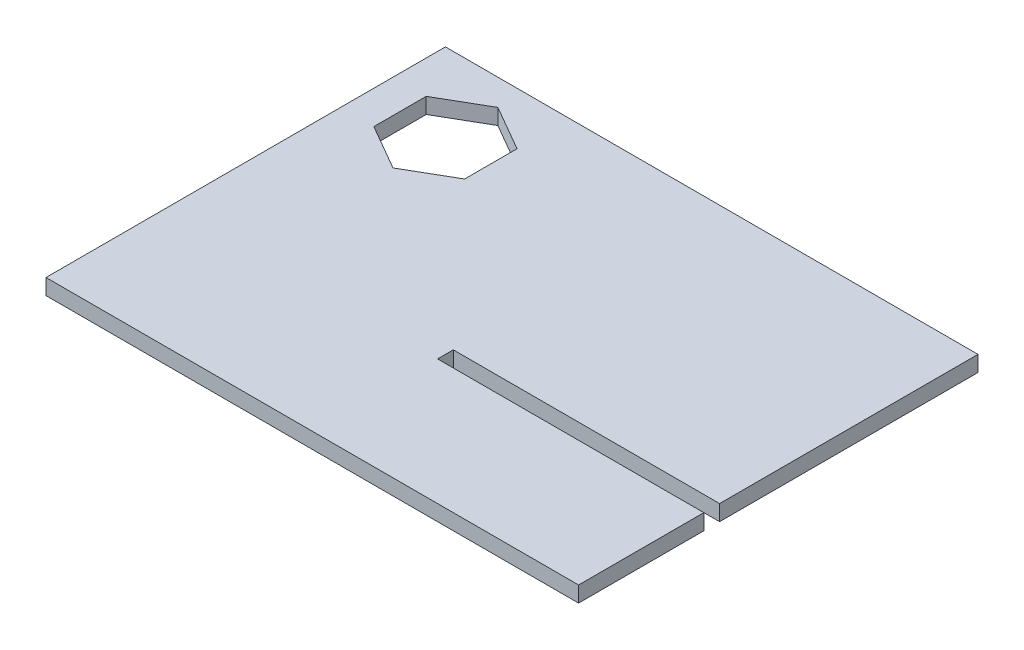
from build123d import *

# Parameters (mm, degrees)
SKETCH1_W           = 101.6
SKETCH1_H           = 76.2
BOSS_EXTRUDE1_DEPTH = 3
SKETCH2_W           = 50.8
SKETCH2_H           = 3
CUT_EXTRUDE1_DEPTH  = 3
CUT_EXTRUDE2_DEPTH  = 3


with BuildPart() as part:
    # Sketch1 → Boss-Extrude1 (new body)
    with BuildSketch(Plane(origin=(0, 0, 0), x_dir=(1, 0, 0), z_dir=(0, 1, 0))):
        with Locations((50.8, 38.1)):
            Rectangle(SKETCH1_W, SKETCH1_H)
    extrude(amount=BOSS_EXTRUDE1_DEPTH)

    # Sketch2 → Cut-Extrude1 (cut)
    with BuildSketch(Plane(origin=(0, 3, 0), x_dir=(1, 0, 0), z_dir=(0, 1, 0))):
        with Locations((76.2, 25.4)):
            Rectangle(SKETCH2_W, SKETCH2_H)
    extrude(amount=-CUT_EXTRUDE1_DEPTH, mode=Mode.SUBTRACT)

    # Sketch3 → Cut-Extrude2 (cut)
    with BuildSketch(Plane(origin=(0, 3, 0), x_dir=(1, 0, 0), z_dir=(0, 1, 0))):
        Polygon((15, 51.2), (23.660254038, 56.2), (23.660254038, 66.2), (15, 71.2), (6.339745962, 66.2), (6.339745962, 56.2), align=None)
    extrude(amount=-CUT_EXTRUDE2_DEPTH, mode=Mode.SUBTRACT)


solid = part.part
